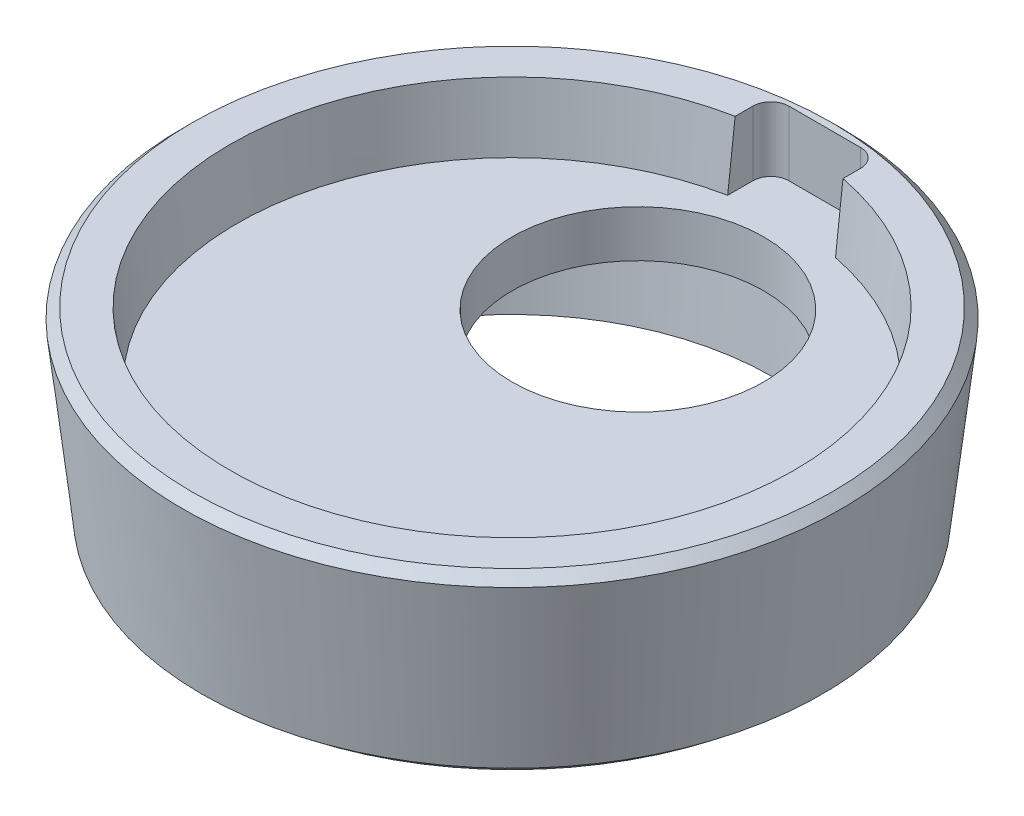
from build123d import *
from OCP.BRepFilletAPI import BRepFilletAPI_MakeChamfer

# Parameters (mm, degrees)
CUT_EXTRUDE1_DEPTH = 28.123421613
SKETCH3_R          = 2
CUT_EXTRUDE2_DEPTH = 2
SKETCH8_R          = 25.2248299
CUT_EXTRUDE4_DEPTH = 12
SKETCH11_R         = 7
CUT_EXTRUDE6_DEPTH = 27.946613887
CUT_EXTRUDE7_DEPTH = 3.6
CHAMFER1_SIZE      = 0.6
CHAMFER1_SIZE2     = 0.68091755
CHAMFER1_SIZE2_2   = 0.542425845


with BuildPart() as part:
    # Sketch1 → Revolve1 (revolve)
    with BuildSketch(Plane.XY, mode=Mode.PRIVATE) as revolve1_sk:
        Polygon((0, 0), (-17.2, 0), (-15.1, -12), (0, -12), align=None)
    revolve(revolve1_sk.sketch.rotate(Axis((0, 0, 0), (0, -1, 0)), 270), axis=Axis((0, 0, 0), (0, -1, 0)))

    # Sketch2 → Cut-Extrude1 (cut, through all)
    with BuildSketch(Plane(origin=(0, 0, 0), x_dir=(1, 0, 0), z_dir=(0, 1, 0))):
        with BuildLine():
            Line((-9.1, -5.8), (-7.3, -5.8))
            Line((-7.3, -5.8), (-7.3, -10.756858277))
            ThreePointArc((-7.3, -10.756858277), (0, -13), (7.3, -10.756858277))
            Line((7.3, -10.756858277), (7.3, -5.8))
            Line((7.3, -5.8), (9.1, -5.8))
            Line((9.1, -5.8), (9.1, -4))
            Line((9.1, -4), (7.3, -4))
            Line((7.3, -4), (7.3, 0))
            Line((7.3, 0), (13, 0))
            ThreePointArc((13, 0), (0, 13), (-13, 0))
            Line((-13, 0), (-7.3, 0))
            Line((-7.3, 0), (-7.3, -4))
            Line((-7.3, -4), (-9.1, -4))
            Line((-9.1, -4), (-9.1, -5.8))
        make_face()
    extrude(amount=-CUT_EXTRUDE1_DEPTH, mode=Mode.SUBTRACT)

    # Sketch3 → Cut-Extrude2 (cut)
    with BuildSketch(Plane(origin=(0, 0, 0), x_dir=(1, 0, 0), z_dir=(0, 1, 0))):
        with Locations((-8.1, -4.9)):
            Circle(SKETCH3_R)
        with Locations((8.1, -4.9)):
            Circle(SKETCH3_R)
    extrude(amount=-CUT_EXTRUDE2_DEPTH, mode=Mode.SUBTRACT)

    # Sketch8 → Cut-Extrude4 (cut)
    with BuildSketch(Plane.XZ.offset(12)):
        Circle(SKETCH8_R)
    extrude(amount=-CUT_EXTRUDE4_DEPTH, mode=Mode.SUBTRACT)


with BuildPart() as body_2:
    # Sketch6 → Revolve2 (revolve)
    with BuildSketch(Plane(origin=(0, 0, 0), x_dir=(0, 0, -1), z_dir=(1, 0, 0))):
        Polygon((17.2, 0), (18.4, 10.6), (15.701886792, 10.6), (15.294339623, 7), (0, 7), (0, 4.4), (15, 4.4), (14.501886792, 0), align=None)
    revolve(axis=Axis((0, 4.4, 0), (0, 1, 0)))

    # Sketch11 → Cut-Extrude6 (cut, through all)
    with BuildSketch(Plane(origin=(0, 7, 0), x_dir=(1, 0, 0), z_dir=(0, 1, 0))):
        with Locations(Location((0, 7, 0), (0, 0, 270))):
            Circle(SKETCH11_R)
    extrude(amount=-CUT_EXTRUDE6_DEPTH, mode=Mode.SUBTRACT)

    # Sketch12 → Cut-Extrude7 (cut)
    with BuildSketch(Plane(origin=(0, 10.6, 0), x_dir=(1, 0, 0), z_dir=(0, 1, 0))):
        with BuildLine():
            Line((3, 16.4), (3, 14.788468719))
            Line((3, 14.788468719), (-3, 14.788468719))
            Line((-3, 14.788468719), (-3, 16.4))
            ThreePointArc((-3, 16.4), (-2.707106781, 17.107106781), (-2, 17.4))
            Line((-2, 17.4), (2, 17.4))
            ThreePointArc((2, 17.4), (2.707106781, 17.107106781), (3, 16.4))
        make_face()
    extrude(amount=-CUT_EXTRUDE7_DEPTH, mode=Mode.SUBTRACT)

    # Chamfer1: one chamfer whose edges measure the first distance from different faces: ONE call of the kernel's chamfer builder (chamfer() names one face for all edges)
    chamfer1_edges_1 = [body_2.edges().sort_by_distance(p)[0] for p in [
        (0, 0, 17.2),
    ]]
    chamfer1_side_1 = [body_2.faces().sort_by_distance(p)[0] for p in [
        (0, 5.3, 17.8),
    ]]
    chamfer1_edges_2 = [body_2.edges().sort_by_distance(p)[0] for p in [
        (0, 10.6, 18.4),
    ]]
    chamfer1_side_2 = [body_2.faces().sort_by_distance(p)[0] for p in [
        (0, 10.6, 17.879569409),
    ]]
    chamfer1 = BRepFilletAPI_MakeChamfer(body_2.part.solid().wrapped)
    for e in chamfer1_edges_1:
        chamfer1.Add(CHAMFER1_SIZE, CHAMFER1_SIZE2, e.wrapped, chamfer1_side_1[0].wrapped)  # the first distance lies on this face
    for e in chamfer1_edges_2:
        chamfer1.Add(CHAMFER1_SIZE, CHAMFER1_SIZE2_2, e.wrapped, chamfer1_side_2[0].wrapped)  # the first distance lies on this face
    add(Compound.cast(chamfer1.Shape()), mode=Mode.REPLACE)


solid = body_2.part
